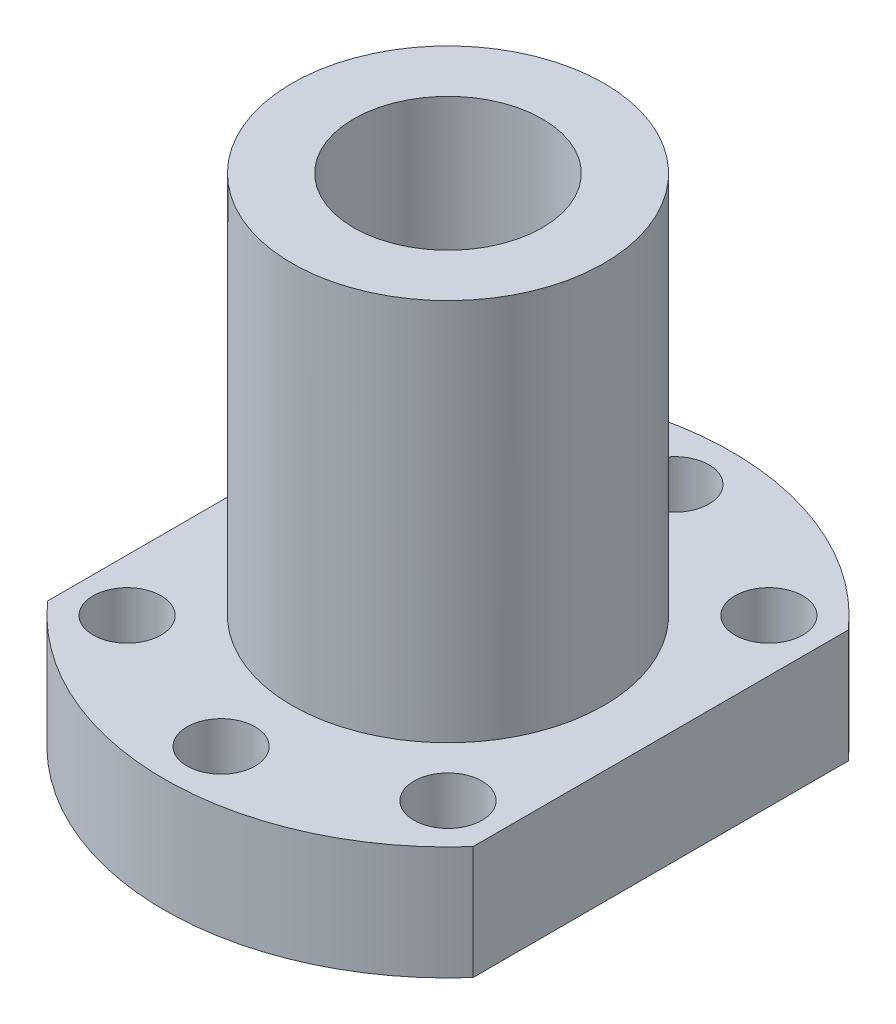
from build123d import *

# Parameters (mm, degrees)
SKETCH_1_R          = 20
EXTRUDE_1_DEPTH     = 8
SKETCH_3_R          = 11
EXTRUDE_2_DEPTH     = 35
CUT_EXTRUDE_1_DEPTH = 46
SKETCH_6_R          = 2.4
CUT_EXTRUDE_2_DEPTH = 44.011626335
SKETCH_7_R          = 6.65
CUT_EXTRUDE_3_DEPTH = 44.011626335


with BuildPart() as part:
    # 草图1 → 凸台-拉伸1 (new body)
    with BuildSketch(Plane(origin=(0, 0, 0), x_dir=(1, 0, 0), z_dir=(0, 1, 0))):
        with Locations(Location((0, 0, 0), (0, 0, 270))):
            Circle(SKETCH_1_R)
    extrude(amount=EXTRUDE_1_DEPTH)

    # 草图3 → 凸台-拉伸2 (add)
    with BuildSketch(Plane.XZ):
        with Locations(Location((0, 0, 0), (0, 0, 270))):
            Circle(SKETCH_3_R)
    extrude(amount=-EXTRUDE_2_DEPTH)

    # 草图4 → 切除-拉伸1 (cut, through all)
    with BuildSketch(Plane.XZ):
        with BuildLine():
            Line((-15, 13.228756555), (-15, -13.228756555))
            ThreePointArc((-15, -13.228756555), (-20, 0), (-15, 13.228756555))
        make_face()
        with BuildLine():
            Line((15, 13.228756555), (15, -13.228756555))
            ThreePointArc((15, -13.228756555), (20, 0), (15, 13.228756555))
        make_face()
    extrude(amount=-CUT_EXTRUDE_1_DEPTH, mode=Mode.SUBTRACT)

    # 草图6 → 切除-拉伸2 (cut, through all)
    with BuildSketch(Plane.XZ):
        with Locations(Location((0, 16, 0), (0, 0, 270))):
            Circle(SKETCH_6_R)
        with Locations(Location((11.313708499, 11.313708499, 0), (0, 0, 270))):
            Circle(SKETCH_6_R)
        with Locations(Location((11.313708499, -11.313708499, 0), (0, 0, 270))):
            Circle(SKETCH_6_R)
        with Locations(Location((0, -16, 0), (0, 0, 270))):
            Circle(SKETCH_6_R)
        with Locations(Location((-11.313708499, -11.313708499, 0), (0, 0, 270))):
            Circle(SKETCH_6_R)
        with Locations(Location((-11.313708499, 11.313708499, 0), (0, 0, 270))):
            Circle(SKETCH_6_R)
    extrude(amount=-CUT_EXTRUDE_2_DEPTH, mode=Mode.SUBTRACT)

    # 草图7 → 切除-拉伸3 (cut, through all)
    with BuildSketch(Plane.XZ):
        with Locations(Location((0, 0, 0), (0, 0, 270))):
            Circle(SKETCH_7_R)
    extrude(amount=-CUT_EXTRUDE_3_DEPTH, mode=Mode.SUBTRACT)


solid = part.part
